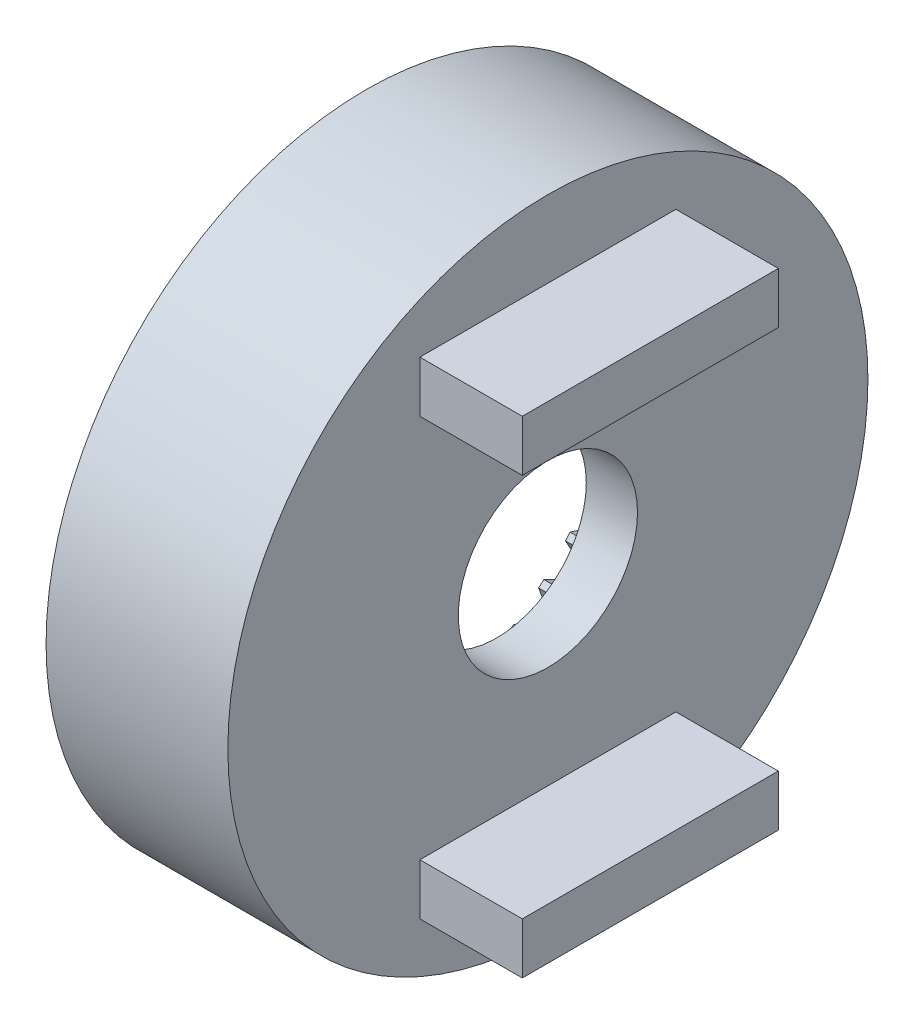
from build123d import *

# Parameters (mm, degrees)
BASPROSKE_W     = 5.1
BASPROSKE_H     = 2.25
TOOTHCUT_DEPTH  = 19.398641254
TEETHCUTS_COUNT = 43
EXTRUDE_START   = 2
SKETCH_1_R      = 12.5
SKETCH_1_R_2    = 3.5
EXTRUDE_1_DEPTH = 2
SKETCH_1_3_W    = 10
SKETCH_1_3_H    = 2
EXTRUDE_2_DEPTH = 4


with BuildPart() as part:
    # BasProSke → Base-Revolve (revolve)
    with BuildSketch(Plane(origin=(0, 0, 0), x_dir=(1, 0, 0), z_dir=(0, 1, 0)), mode=Mode.PRIVATE) as base_revolve_sk:
        with Locations((2.55, 11.375)):
            Rectangle(BASPROSKE_W, BASPROSKE_H)
    revolve(base_revolve_sk.sketch.rotate(Axis((-10, 0, 0), (1, 0, 0)), 180), axis=Axis((-10, 0, 0), (1, 0, 0)))

    # TooCutSke → ToothCut (cut, through all)
    with BuildSketch(Plane(origin=(0, 0, 0), x_dir=(0, 0, -1), z_dir=(1, 0, 0))):
        with BuildLine():
            ThreePointArc((0.617808092, 10.205917809), (0.414784326, 10.804496123), (0.142896438, 11.375102488))
            ThreePointArc((0.142896438, 11.375102488), (0, 11.376), (-0.142896438, 11.375102488))
            ThreePointArc((-0.142896438, 11.375102488), (-0.414784326, 10.804496123), (-0.617808092, 10.205917809))
            ThreePointArc((-0.617808092, 10.205917809), (0, 10.2246), (0.617808092, 10.205917809))
        make_face()
    toothcut = extrude(amount=TOOTHCUT_DEPTH, mode=Mode.SUBTRACT)

    # TeethCuts: ToothCut ×43 about axis
    teethcuts_axis = Axis((0, 0, 0), (1, 0, 0))
    for i in range(1, TEETHCUTS_COUNT):
        add(toothcut.rotate(teethcuts_axis, i * 360 / TEETHCUTS_COUNT), mode=Mode.SUBTRACT)

    # 草图1 → 凸台-拉伸1 (add)
    with BuildSketch(Plane(origin=(5.1, 0, 0), x_dir=(0, 0, -1), z_dir=(1, 0, 0)).offset(EXTRUDE_START)):
        with Locations(Location((0, 0, 0), (0, 0, 180))):
            Circle(SKETCH_1_R)
        Circle(SKETCH_1_R_2, mode=Mode.SUBTRACT)
    extrude(amount=-EXTRUDE_1_DEPTH)

    # 草图1<3> → 凸台-拉伸2 (add)
    with BuildSketch(Plane(origin=(5.1, 0, 0), x_dir=(0, 0, -1), z_dir=(1, 0, 0)).offset(EXTRUDE_START)):
        with Locations((0, 8.5)):
            Rectangle(SKETCH_1_3_W, SKETCH_1_3_H)
        with Locations((0, -8.5)):
            Rectangle(SKETCH_1_3_W, SKETCH_1_3_H)
    extrude(amount=EXTRUDE_2_DEPTH)


solid = part.part
